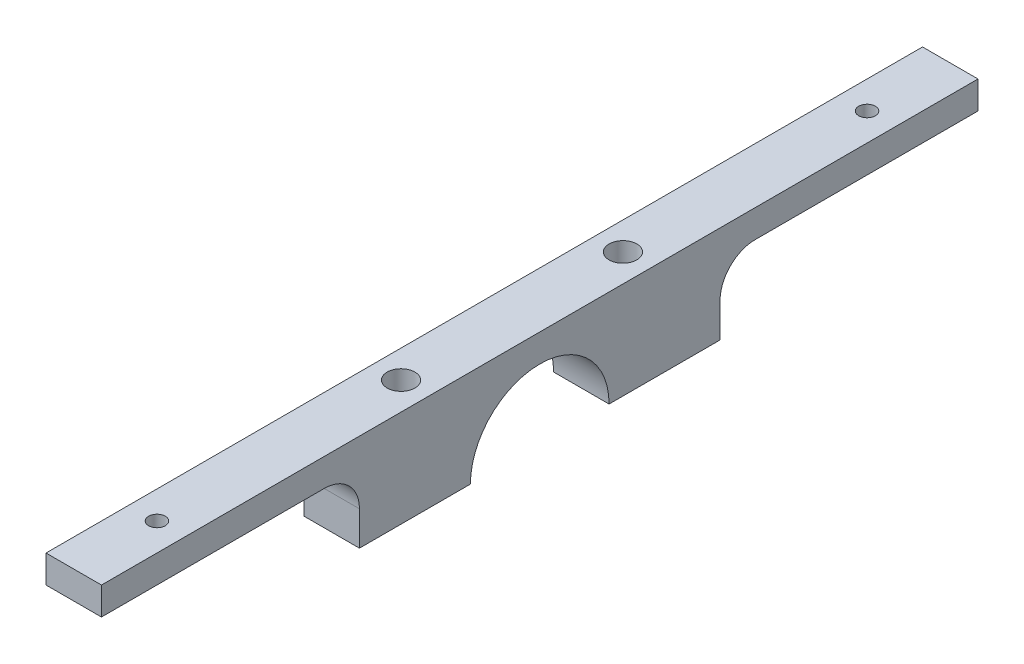
from build123d import *

# Parameters (mm, degrees)
BOSS_EXTRUDE1_DEPTH     = 10
CUT_EXTRUDE1_DEPTH      = 81.605520903
CUT_EXTRUDE1_DEPTH_BACK = 81.605520903
SKETCH2_R               = 1.5
SKETCH2_R_2             = 2.5
FILLET1_R               = 6.35


with BuildPart() as part:
    # Sketch1 → Boss-Extrude1 (new body)
    with BuildSketch(Plane(origin=(0, 0, 0), x_dir=(0, 0, -1), z_dir=(1, 0, 0))):
        with BuildLine():
            Line((-79, 12.5), (-32.5, 12.5))
            Line((-32.5, 12.5), (-32.5, 0))
            Line((-32.5, 0), (-12.5, 0))
            ThreePointArc((-12.5, 0), (0, 12.5), (12.5, 0))
            Line((12.5, 0), (32.5, 0))
            Line((32.5, 0), (32.5, 12.5))
            Line((32.5, 12.5), (79, 12.5))
            Line((79, 12.5), (79, 17.5))
            Line((79, 17.5), (-79, 17.5))
            Line((-79, 17.5), (-79, 12.5))
        make_face()
    extrude(amount=BOSS_EXTRUDE1_DEPTH)

    # Sketch2 → Cut-Extrude1 (cut, two sides: drawn at the far end of the back side and taken through both)
    with BuildSketch(Plane.XZ.offset(-12.5).offset(-CUT_EXTRUDE1_DEPTH_BACK)):
        with Locations(Location((5, 64, 0), (0, 0, 270))):
            Circle(SKETCH2_R)
        with Locations(Location((5, -64, 0), (0, 0, 90))):
            Circle(SKETCH2_R)
        with Locations(Location((5, 20, 0), (0, 0, 270))):
            Circle(SKETCH2_R_2)
        with Locations(Location((5, -20, 0), (0, 0, 90))):
            Circle(SKETCH2_R_2)
    extrude(amount=CUT_EXTRUDE1_DEPTH + CUT_EXTRUDE1_DEPTH_BACK, mode=Mode.SUBTRACT)

    # Fillet1
    fillet1_edges = [part.edges().sort_by_distance(p)[0] for p in [
        (5, 12.5, 32.5),
        (5, 12.5, -32.5),
    ]]
    fillet(fillet1_edges, radius=FILLET1_R)


solid = part.part
